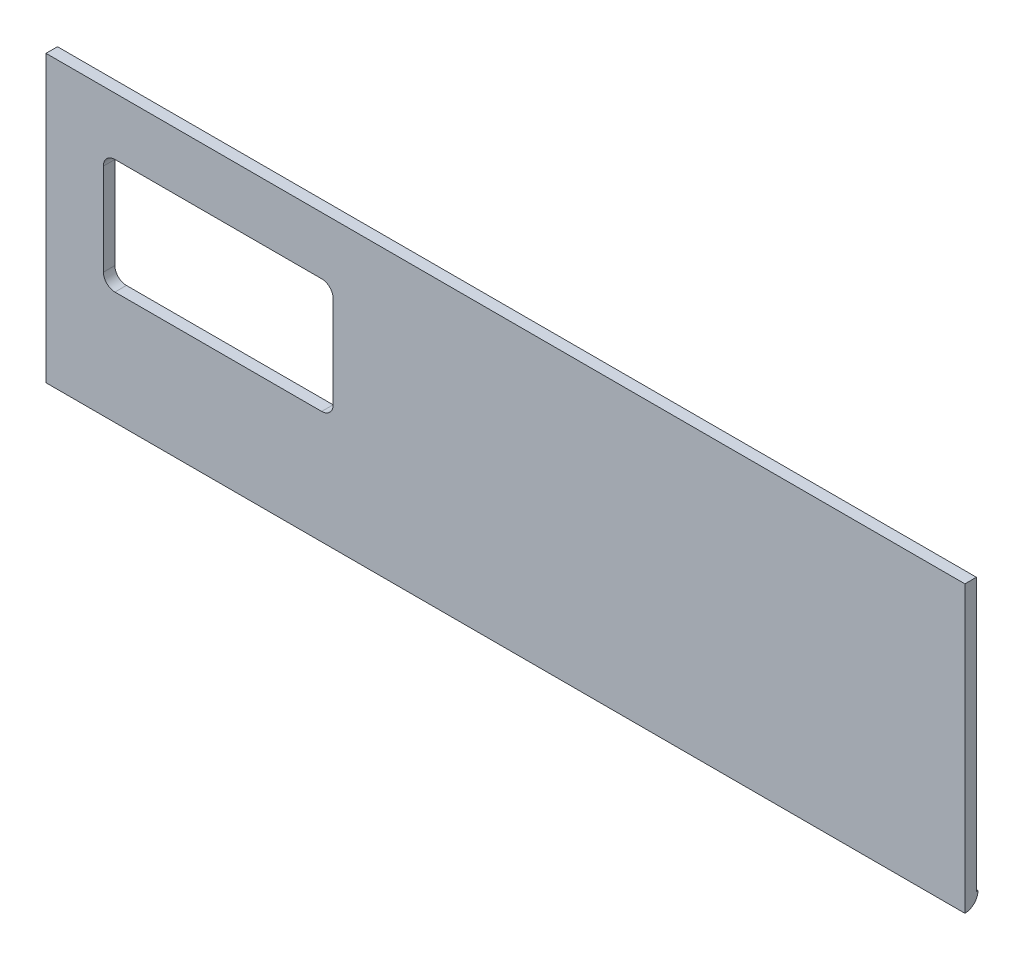
from build123d import *

# Parameters (mm, degrees)
SKETCH1_W           = 80
SKETCH1_H           = 24.7
BOSS_EXTRUDE1_DEPTH = 1
CUT_EXTRUDE1_DEPTH  = 100
CUT_EXTRUDE2_DEPTH  = 1
BOSS_EXTRUDE2_START = -80
BOSS_EXTRUDE2_DEPTH = 80


with BuildPart() as part:
    # Sketch1 → Boss-Extrude1 (new body)
    with BuildSketch(Plane.XY):
        Rectangle(SKETCH1_W, SKETCH1_H)
    extrude(amount=BOSS_EXTRUDE1_DEPTH)

    # Sketch2 → Cut-Extrude1 (cut)
    with BuildSketch(Plane.ZY.offset(40)):
        with BuildLine():
            Line((0, -12.35), (1, -12.35))
            ThreePointArc((1, -12.35), (0.292893219, -12.057106781), (0, -11.35))
            Line((0, -11.35), (0, -12.35))
        make_face()
    extrude(amount=-CUT_EXTRUDE1_DEPTH, mode=Mode.SUBTRACT)

    # Sketch3 → Cut-Extrude2 (cut)
    with BuildSketch(Plane(origin=(0, 0, 0), x_dir=(-1, 0, 0), z_dir=(0, 0, -1))):
        with BuildLine():
            Line((34, 7.35), (16, 7.35))
            ThreePointArc((16, 7.35), (15.292893219, 7.057106781), (15, 6.35))
            Line((15, 6.35), (15, -1.65))
            ThreePointArc((15, -1.65), (15.292893219, -2.357106781), (16, -2.65))
            Line((16, -2.65), (34, -2.65))
            ThreePointArc((34, -2.65), (34.707106781, -2.357106781), (35, -1.65))
            Line((35, -1.65), (35, 6.35))
            ThreePointArc((35, 6.35), (34.707106781, 7.057106781), (34, 7.35))
        make_face()
    extrude(amount=-CUT_EXTRUDE2_DEPTH, mode=Mode.SUBTRACT)

    # Sketch4 → Boss-Extrude2 (add)
    with BuildSketch(Plane(origin=(40, 0, 0), x_dir=(0, 0, -1), z_dir=(1, 0, 0)).offset(BOSS_EXTRUDE2_START)):
        with BuildLine():
            Line((-1, -12.49), (-1, -12.35))
            ThreePointArc((-1, -12.35), (-0.292893219, -12.057106781), (0, -11.35))
            Line((0, -11.35), (0.14, -11.35))
            ThreePointArc((0.14, -11.35), (-0.193898269, -12.156101731), (-1, -12.49))
        make_face()
    extrude(amount=BOSS_EXTRUDE2_DEPTH)


solid = part.part
